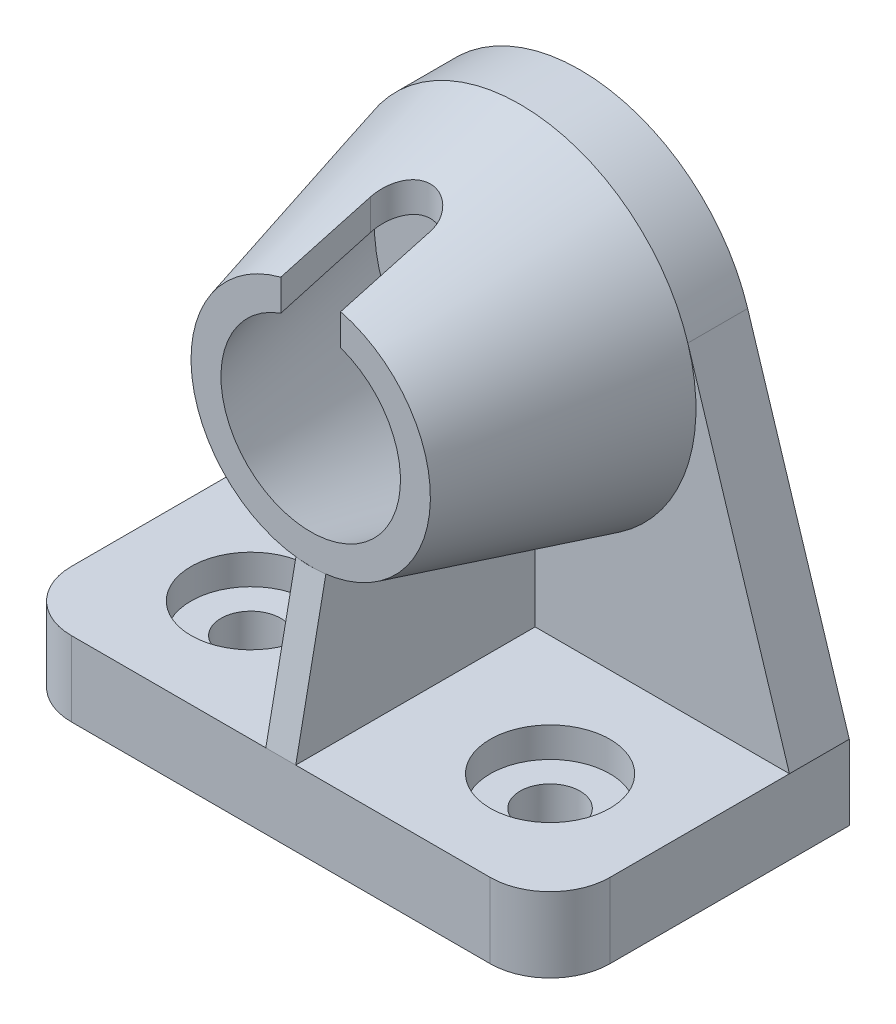
from build123d import *

# Parameters (mm, degrees)
SKETCH2_R           = 20
BOSS_EXTRUDE1_DEPTH = 20
BOSS_EXTRUDE2_DEPTH = 25
CUT_EXTRUDE1_DEPTH  = 172.537167984
RIB1_REACH          = 173.537
SKETCH5_WALL_W      = 396.064531104
SKETCH5_WALL_H      = 10
HOLE1_D             = 20
HOLE1_DEPTH         = 25
HOLE1_CBORE_D       = 40
HOLE1_CBORE_DEPTH   = 10


with BuildPart() as part:
    # Sketch1 → Revolve1 (revolve)
    with BuildSketch(Plane(origin=(0, 0, 0), x_dir=(0, 0, -1), z_dir=(1, 0, 0)), mode=Mode.PRIVATE) as revolve1_sk:
        Polygon((0, 30), (0, 40), (70, 58.75644347), (70, 48.75644347), align=None)
    revolve(revolve1_sk.sketch.rotate(Axis((0, 0, 0), (0, 0, -1)), 90), axis=Axis((0, 0, 0), (0, 0, -1)))

    # Sketch2 → Boss-Extrude1 (add)
    with BuildSketch(Plane(origin=(0, 0, -70), x_dir=(-1, 0, 0), z_dir=(0, 0, -1))):
        with BuildLine():
            Line((90, -90), (-90, -90))
            Line((-90, -90), (-56.03473707, 17.675629856))
            ThreePointArc((-56.03473707, 17.675629856), (0, 58.75644347), (56.03473707, 17.675629856))
            Line((56.03473707, 17.675629856), (90, -90))
        make_face()
        Circle(SKETCH2_R, mode=Mode.SUBTRACT)
    extrude(amount=BOSS_EXTRUDE1_DEPTH)

    # Sketch3 → Boss-Extrude2 (add)
    with BuildSketch(Plane.XZ.offset(90)):
        with BuildLine():
            Line((-90, -90), (90, -90))
            Line((90, -90), (90, -10))
            ThreePointArc((90, -10), (84.142135624, 4.142135624), (70, 10))
            Line((70, 10), (-70, 10))
            ThreePointArc((-70, 10), (-84.142135624, 4.142135624), (-90, -10))
            Line((-90, -10), (-90, -90))
        make_face()
    extrude(amount=BOSS_EXTRUDE2_DEPTH)

    # Sketch4 → Cut-Extrude1 (cut, through all)
    with BuildSketch(Plane(origin=(0, 0, 0), x_dir=(1, 0, 0), z_dir=(0, 1, 0))):
        with BuildLine():
            Line((-10, -30), (-10, 30))
            ThreePointArc((-10, 30), (0, 40), (10, 30))
            Line((10, 30), (10, -30))
            ThreePointArc((10, -30), (0, -40), (-10, -30))
        make_face()
    extrude(amount=CUT_EXTRUDE1_DEPTH, mode=Mode.SUBTRACT)

    # Sketch5 wall → Rib1 (add, up to next)
    with BuildSketch(Plane(origin=(0, -65, 5), x_dir=(0, 0.980580675691, -0.196116135138), z_dir=(0, 0.196116135138, 0.980580675691)), mode=Mode.PRIVATE) as rib1_sk1:
        Rectangle(SKETCH5_WALL_W, SKETCH5_WALL_H)
    rib1_tool1 = extrude(rib1_sk1.sketch, amount=-RIB1_REACH, mode=Mode.PRIVATE) - part.part
    add(rib1_tool1.solids().sort_by_distance((0, -65, 5))[0])

    # Hole1
    with Locations(Plane(origin=(0, -90, 0), x_dir=(1, 0, 0), z_dir=(0, 1, 0))):
        with Locations((50, 30)):
            hole1 = CounterBoreHole(HOLE1_D / 2, HOLE1_CBORE_D / 2, HOLE1_CBORE_DEPTH, depth=HOLE1_DEPTH)

    # Mirror1: Hole1 across plane
    add(hole1.mirror(Plane(origin=(0, 0, 0), x_dir=(0, 0, 1), z_dir=(1, 0, 0))), mode=Mode.SUBTRACT)


solid = part.part
